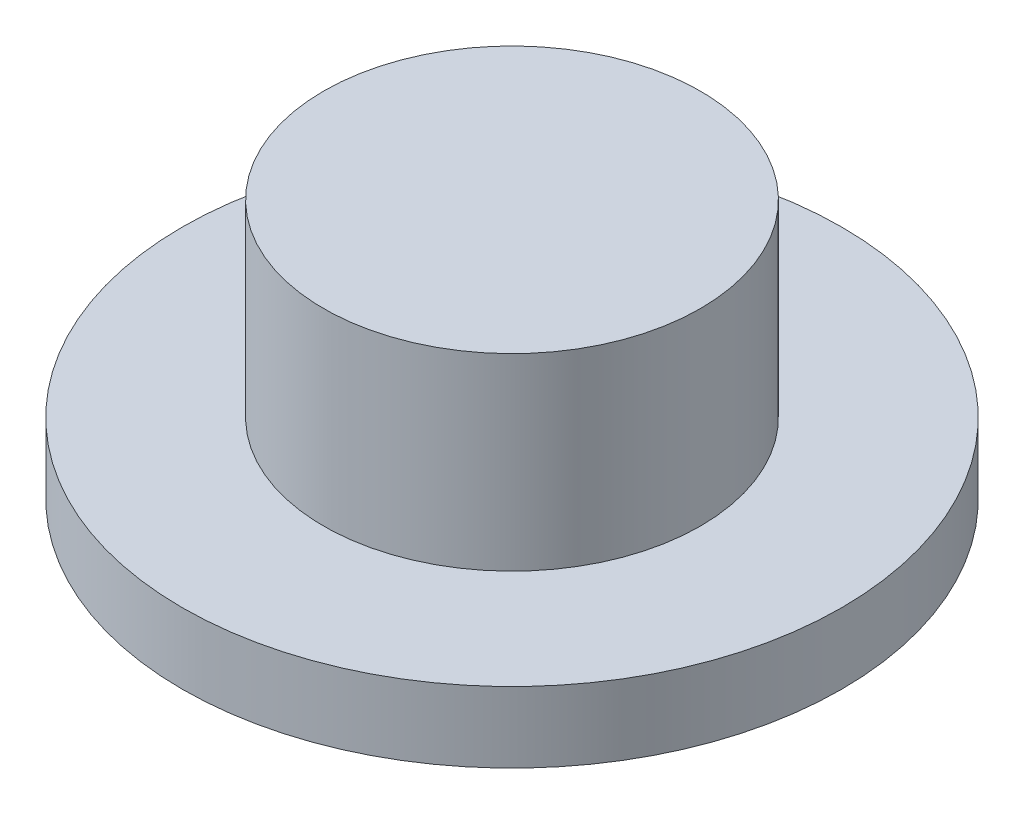
from build123d import *


with BuildPart() as part:
    # Sketch1 → Revolve1 (revolve)
    with BuildSketch(Plane.XY):
        Polygon((0, 5.5), (4, 5.5), (4, 1.5), (7, 1.5), (7, 0), (2, 0), (1.75, 1), (0, 1), align=None)
    revolve(axis=Axis((0, 5.5, 0), (0, 1, 0)))


solid = part.part
